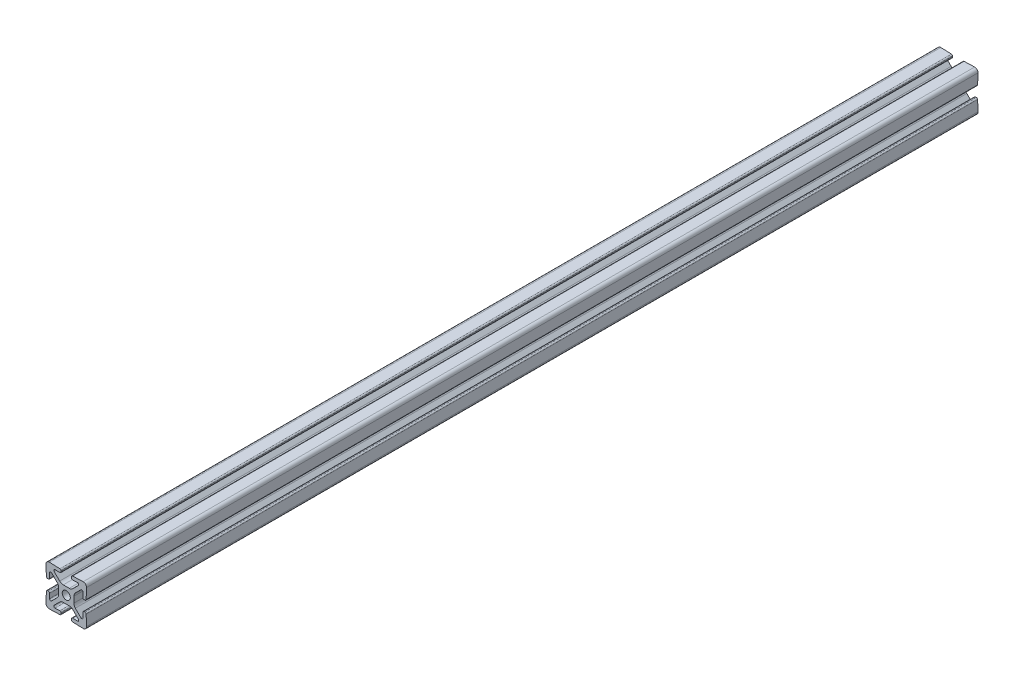
from build123d import *

# Parameters (mm, degrees)
BOSS_EXTRUDE1_DEPTH = 609.6
CIRPATTERN1_COUNT   = 4
CUT_EXTRUDE1_DEPTH  = 660.4


with BuildPart() as part:
    # Sketch3 → Boss-Extrude1 (new, symmetric)
    with BuildSketch(Plane.XY):
        with BuildLine():
            Line((0, 4.7625), (-1.884807374, 4.7625))
            ThreePointArc((-1.884807374, 4.7625), (-3.099827272, 5.004182484), (-4.129871405, 5.69243597))
            Line((-4.129871405, 5.69243597), (-7.599623114, 9.162187679))
            ThreePointArc((-7.599623114, 9.162187679), (-7.759888701, 10.006330839), (-7.033220609, 10.464824259))
            Line((-7.033220609, 10.464824259), (-4.047481702, 10.360559959))
            ThreePointArc((-4.047481702, 10.360559959), (-3.501205536, 10.564804249), (-3.259352476, 11.095502353))
            Line((-3.259352476, 11.095502353), (-3.23896419, 11.679346474))
            ThreePointArc((-3.23896419, 11.679346474), (-3.443208479, 12.225622641), (-3.973906584, 12.467475701))
            Line((-3.973906584, 12.467475701), (-10.597084223, 12.698762161))
            ThreePointArc((-10.597084223, 12.698762161), (-12.104840979, 12.104840979), (-12.698762161, 10.597084223))
            Line((-12.698762161, 10.597084223), (-12.467475701, 3.973906584))
            ThreePointArc((-12.467475701, 3.973906584), (-12.225622641, 3.443208479), (-11.679346474, 3.23896419))
            Line((-11.679346474, 3.23896419), (-11.095502353, 3.259352476))
            ThreePointArc((-11.095502353, 3.259352476), (-10.564804249, 3.501205536), (-10.360559959, 4.047481702))
            Line((-10.360559959, 4.047481702), (-10.464824259, 7.033220609))
            ThreePointArc((-10.464824259, 7.033220609), (-10.006330839, 7.759888701), (-9.162187679, 7.599623114))
            Line((-9.162187679, 7.599623114), (-5.69243597, 4.129871405))
            ThreePointArc((-5.69243597, 4.129871405), (-5.004182484, 3.099827272), (-4.7625, 1.884807374))
            Line((-4.7625, 1.884807374), (-4.7625, 0))
            Line((-4.7625, 0), (-2.54, 0))
            ThreePointArc((-2.54, 0), (-1.796051224, 1.796051224), (0, 2.54))
            Line((0, 2.54), (0, 4.7625))
        make_face()
    boss_extrude1 = extrude(amount=BOSS_EXTRUDE1_DEPTH, both=True)

    # CirPattern1: Boss-Extrude1 ×4 about axis
    cirpattern1_axis = Axis((0, 0, 0), (0, 0, 1))
    for i in range(1, CIRPATTERN1_COUNT):
        add(boss_extrude1.rotate(cirpattern1_axis, i * 360 / CIRPATTERN1_COUNT))

    # Sketch4 → Cut-Extrude1 (cut)
    with BuildSketch(Plane.XY.offset(609.6)):
        with BuildLine():
            Line((1.884807374, 4.7625), (-1.884807374, 4.7625))
            ThreePointArc((-1.884807374, 4.7625), (-3.099827272, 5.004182484), (-4.129871405, 5.69243597))
            Line((-4.129871405, 5.69243597), (-7.599623114, 9.162187679))
            ThreePointArc((-7.599623114, 9.162187679), (-7.759888701, 10.006330839), (-7.033220609, 10.464824259))
            Line((-7.033220609, 10.464824259), (-4.047481702, 10.360559959))
            ThreePointArc((-4.047481702, 10.360559959), (-3.501205536, 10.564804249), (-3.259352476, 11.095502353))
            Line((-3.259352476, 11.095502353), (-3.23896419, 11.679346474))
            ThreePointArc((-3.23896419, 11.679346474), (-3.443208479, 12.225622641), (-3.973906584, 12.467475701))
            Line((-3.973906584, 12.467475701), (-10.597084223, 12.698762161))
            ThreePointArc((-10.597084223, 12.698762161), (-12.104840979, 12.104840979), (-12.698762161, 10.597084223))
            Line((-12.698762161, 10.597084223), (-12.467475701, 3.973906584))
            ThreePointArc((-12.467475701, 3.973906584), (-12.225622641, 3.443208479), (-11.679346474, 3.23896419))
            Line((-11.679346474, 3.23896419), (-11.095502353, 3.259352476))
            ThreePointArc((-11.095502353, 3.259352476), (-10.564804249, 3.501205536), (-10.360559959, 4.047481702))
            Line((-10.360559959, 4.047481702), (-10.464824259, 7.033220609))
            ThreePointArc((-10.464824259, 7.033220609), (-10.006330839, 7.759888701), (-9.162187679, 7.599623114))
            Line((-9.162187679, 7.599623114), (-5.69243597, 4.129871405))
            ThreePointArc((-5.69243597, 4.129871405), (-5.004182484, 3.099827272), (-4.7625, 1.884807374))
            Line((-4.7625, 1.884807374), (-4.7625, -1.884807374))
            ThreePointArc((-4.7625, -1.884807374), (-5.004182484, -3.099827272), (-5.69243597, -4.129871405))
            Line((-5.69243597, -4.129871405), (-9.162187679, -7.599623114))
            ThreePointArc((-9.162187679, -7.599623114), (-10.006330839, -7.759888701), (-10.464824259, -7.033220609))
            Line((-10.464824259, -7.033220609), (-10.360559959, -4.047481702))
            ThreePointArc((-10.360559959, -4.047481702), (-10.564804249, -3.501205536), (-11.095502353, -3.259352476))
            Line((-11.095502353, -3.259352476), (-11.679346474, -3.23896419))
            ThreePointArc((-11.679346474, -3.23896419), (-12.225622641, -3.443208479), (-12.467475701, -3.973906584))
            Line((-12.467475701, -3.973906584), (-12.698762161, -10.597084223))
            ThreePointArc((-12.698762161, -10.597084223), (-12.104840979, -12.104840979), (-10.597084223, -12.698762161))
            Line((-10.597084223, -12.698762161), (-3.973906584, -12.467475701))
            ThreePointArc((-3.973906584, -12.467475701), (-3.443208479, -12.225622641), (-3.23896419, -11.679346474))
            Line((-3.23896419, -11.679346474), (-3.259352476, -11.095502353))
            ThreePointArc((-3.259352476, -11.095502353), (-3.501205536, -10.564804249), (-4.047481702, -10.360559959))
            Line((-4.047481702, -10.360559959), (-7.033220609, -10.464824259))
            ThreePointArc((-7.033220609, -10.464824259), (-7.759888701, -10.006330839), (-7.599623114, -9.162187679))
            Line((-7.599623114, -9.162187679), (-4.129871405, -5.69243597))
            ThreePointArc((-4.129871405, -5.69243597), (-3.099827272, -5.004182484), (-1.884807374, -4.7625))
            Line((-1.884807374, -4.7625), (1.884807374, -4.7625))
            ThreePointArc((1.884807374, -4.7625), (3.099827272, -5.004182484), (4.129871405, -5.69243597))
            Line((4.129871405, -5.69243597), (7.599623114, -9.162187679))
            ThreePointArc((7.599623114, -9.162187679), (7.759888701, -10.006330839), (7.033220609, -10.464824259))
            Line((7.033220609, -10.464824259), (4.047481702, -10.360559959))
            ThreePointArc((4.047481702, -10.360559959), (3.501205536, -10.564804249), (3.259352476, -11.095502353))
            Line((3.259352476, -11.095502353), (3.23896419, -11.679346474))
            ThreePointArc((3.23896419, -11.679346474), (3.443208479, -12.225622641), (3.973906584, -12.467475701))
            Line((3.973906584, -12.467475701), (10.597084223, -12.698762161))
            ThreePointArc((10.597084223, -12.698762161), (12.104840979, -12.104840979), (12.698762161, -10.597084223))
            Line((12.698762161, -10.597084223), (12.467475701, -3.973906584))
            ThreePointArc((12.467475701, -3.973906584), (12.225622641, -3.443208479), (11.679346474, -3.23896419))
            Line((11.679346474, -3.23896419), (11.095502353, -3.259352476))
            ThreePointArc((11.095502353, -3.259352476), (10.564804249, -3.501205536), (10.360559959, -4.047481702))
            Line((10.360559959, -4.047481702), (10.464824259, -7.033220609))
            ThreePointArc((10.464824259, -7.033220609), (10.006330839, -7.759888701), (9.162187679, -7.599623114))
            Line((9.162187679, -7.599623114), (5.69243597, -4.129871405))
            ThreePointArc((5.69243597, -4.129871405), (5.004182484, -3.099827272), (4.7625, -1.884807374))
            Line((4.7625, -1.884807374), (4.7625, 1.884807374))
            ThreePointArc((4.7625, 1.884807374), (5.004182484, 3.099827272), (5.69243597, 4.129871405))
            Line((5.69243597, 4.129871405), (9.162187679, 7.599623114))
            ThreePointArc((9.162187679, 7.599623114), (10.006330839, 7.759888701), (10.464824259, 7.033220609))
            Line((10.464824259, 7.033220609), (10.360559959, 4.047481702))
            ThreePointArc((10.360559959, 4.047481702), (10.564804249, 3.501205536), (11.095502353, 3.259352476))
            Line((11.095502353, 3.259352476), (11.679346474, 3.23896419))
            ThreePointArc((11.679346474, 3.23896419), (12.225622641, 3.443208479), (12.467475701, 3.973906584))
            Line((12.467475701, 3.973906584), (12.698762161, 10.597084223))
            ThreePointArc((12.698762161, 10.597084223), (12.104840979, 12.104840979), (10.597084223, 12.698762161))
            Line((10.597084223, 12.698762161), (3.973906584, 12.467475701))
            ThreePointArc((3.973906584, 12.467475701), (3.443208479, 12.225622641), (3.23896419, 11.679346474))
            Line((3.23896419, 11.679346474), (3.259352476, 11.095502353))
            ThreePointArc((3.259352476, 11.095502353), (3.501205536, 10.564804249), (4.047481702, 10.360559959))
            Line((4.047481702, 10.360559959), (7.033220609, 10.464824259))
            ThreePointArc((7.033220609, 10.464824259), (7.759888701, 10.006330839), (7.599623114, 9.162187679))
            Line((7.599623114, 9.162187679), (4.129871405, 5.69243597))
            ThreePointArc((4.129871405, 5.69243597), (3.099827272, 5.004182484), (1.884807374, 4.7625))
        make_face()
    extrude(amount=-CUT_EXTRUDE1_DEPTH, mode=Mode.SUBTRACT)


solid = part.part
